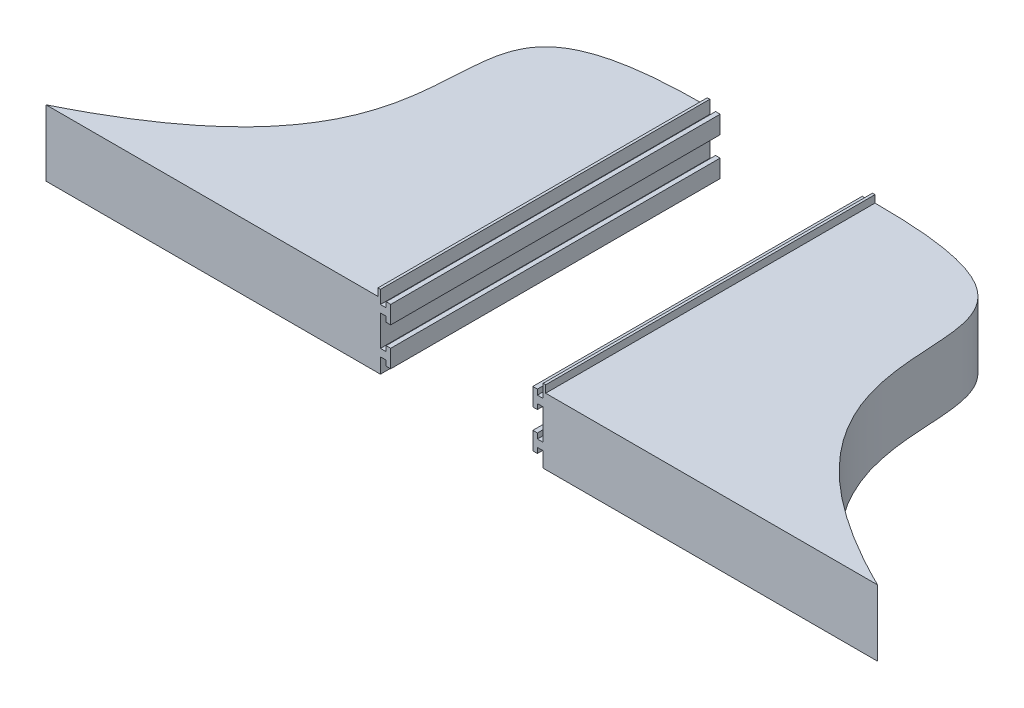
from build123d import *

# Parameters (mm, degrees)
BOSS_EXTRUDE1_DEPTH      = 130
BOSS_EXTRUDE2_DEPTH      = 6
BOSS_EXTRUDE2_DEPTH_BACK = 20.105473


with BuildPart() as part:
    # Sketch1 → Boss-Extrude1 (new body)
    with BuildSketch(Plane.XY.offset(-130)):
        Polygon((-32.1, -15.049651452), (-32.1, -21), (-33.1, -21), (-33.1, 8), (-32.1, 8), (-32.1, 2.830782278), (-29.842797906, 2.830782278), (-29.842797906, 4.9), (-28.042797906, 4.9), (-28.042797906, -2.118869174), (-29.842797906, -2.118869174), (-29.842797906, -0.049651452), (-32.1, -0.049651452), (-32.1, -12.169217722), (-29.842797906, -12.169217722), (-29.842797906, -10.1), (-28.042797906, -10.1), (-28.042797906, -17.118869174), (-29.842797906, -17.118869174), (-29.842797906, -15.049651452), align=None)
    extrude(amount=BOSS_EXTRUDE1_DEPTH)

    # Sketch2 → Boss-Extrude2 (add, two sides: drawn at the far end of the back side and taken through both)
    with BuildSketch(Plane(origin=(75.296860797, -0.894527219, -218.700782843), x_dir=(1, 0, 0), z_dir=(0, 1, 0)).offset(-BOSS_EXTRUDE2_DEPTH_BACK)):
        with BuildLine():
            Line((-108.396860797, -88.700782843), (-108.396860797, -218.700782843))
            Line((-108.396860797, -218.700782843), (-239.376748065, -218.700782843))
            add(Edge.make_bspline(
                [(-108.396860797, -88.700782843), (-226.624669083, -88.700782843), (-107.396860797, -153.700782843), (-239.376748065, -218.700782843)],
                knots=[0, 0, 0, 0, 1, 1, 1, 1], degree=3))
        make_face()
    extrude(amount=BOSS_EXTRUDE2_DEPTH + BOSS_EXTRUDE2_DEPTH_BACK)


with BuildPart() as body_2:
    # Mirror1: mirrored copy
    add(part.part.mirror(Plane(origin=(0, 0, 0), x_dir=(0, 0, 1), z_dir=(1, 0, 0))))


solid = Compound([part.part, body_2.part])
